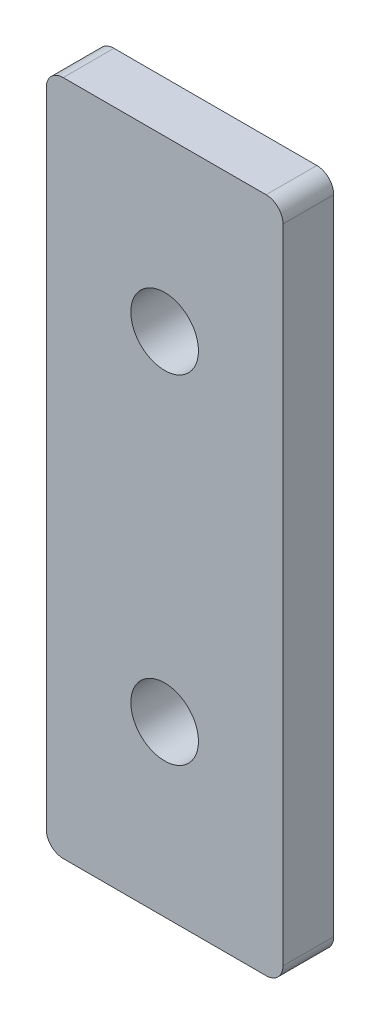
from build123d import *

# Parameters (mm, degrees)
SKETCH1_W           = 14
SKETCH1_H           = 40
SKETCH1_R           = 2
BOSS_EXTRUDE1_DEPTH = 3
FILLET1_R           = 1


with BuildPart() as part:
    # Sketch1 → Boss-Extrude1 (new body)
    with BuildSketch(Plane.XY):
        with Locations((7, 20)):
            Rectangle(SKETCH1_W, SKETCH1_H)
        with Locations((7, 10)):
            Circle(SKETCH1_R, mode=Mode.SUBTRACT)
        with Locations((7, 30)):
            Circle(SKETCH1_R, mode=Mode.SUBTRACT)
    extrude(amount=BOSS_EXTRUDE1_DEPTH)

    # Fillet1
    fillet1_edges = [part.edges().sort_by_distance(p)[0] for p in [
        (0, 40, 1.5),
        (14, 40, 1.5),
        (14, 0, 1.5),
        (0, 0, 1.5),
    ]]
    fillet(fillet1_edges, radius=FILLET1_R)


solid = part.part
